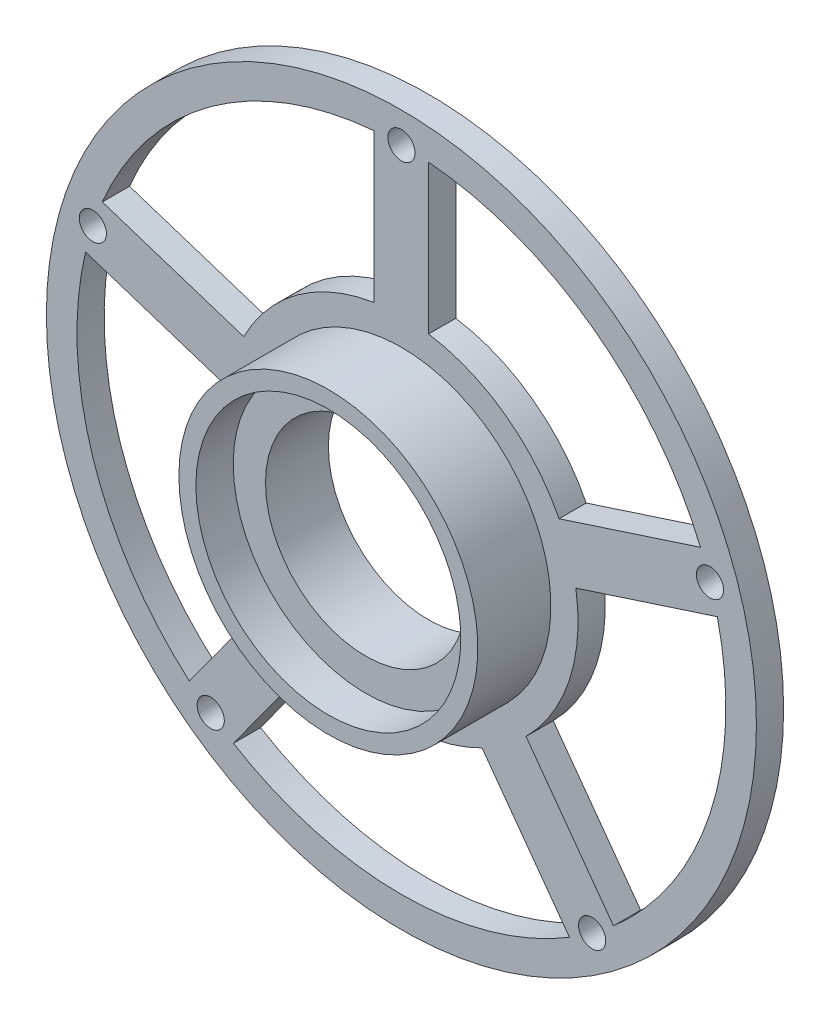
from build123d import *

# Parameters (mm, degrees)
SKETCH2_R          = 2.032
CUT_EXTRUDE1_DEPTH = 76.865254735
CIRPATTERN1_COUNT  = 5


with BuildPart() as part:
    # Sketch1 → Revolve1 (revolve)
    with BuildSketch(Plane(origin=(0, 0, 0), x_dir=(0, 0, -1), z_dir=(1, 0, 0)), mode=Mode.PRIVATE) as revolve1_sk:
        Polygon((0, 14.986), (-9.398, 14.986), (-9.398, 19.812), (-14.986, 19.812), (-14.986, 22.352), (-4.064, 22.352), (-4.064, 53.086), (0, 53.086), align=None)
    revolve(revolve1_sk.sketch.rotate(Axis((0, 0, 0), (0, 0, 1)), 90), axis=Axis((0, 0, 0), (0, 0, 1)))

    # Sketch2 → Cut-Extrude1 (cut, through all)
    with BuildSketch(Plane.XY.offset(4.064)):
        with Locations((0, 48.514)):
            Circle(SKETCH2_R)
        with BuildLine():
            Line((4.064, 48.343480429), (4.064, 26.1015126))
            ThreePointArc((4.064, 26.1015126), (15.526935225, 21.370992923), (23.568168578, 11.930904654))
            Line((23.568168578, 11.930904654), (44.721537017, 18.804050702))
            ThreePointArc((44.721537017, 18.804050702), (28.51581373, 39.248650465), (4.064, 48.343480429))
        make_face()
    cut_extrude1 = extrude(amount=-CUT_EXTRUDE1_DEPTH, mode=Mode.SUBTRACT)

    # CirPattern1: Cut-Extrude1 ×5 about axis
    cirpattern1_axis = Axis((0, 0, 0), (0, 0, 1))
    for i in range(1, CIRPATTERN1_COUNT):
        add(cut_extrude1.rotate(cirpattern1_axis, i * 360 / CIRPATTERN1_COUNT), mode=Mode.SUBTRACT)


solid = part.part
